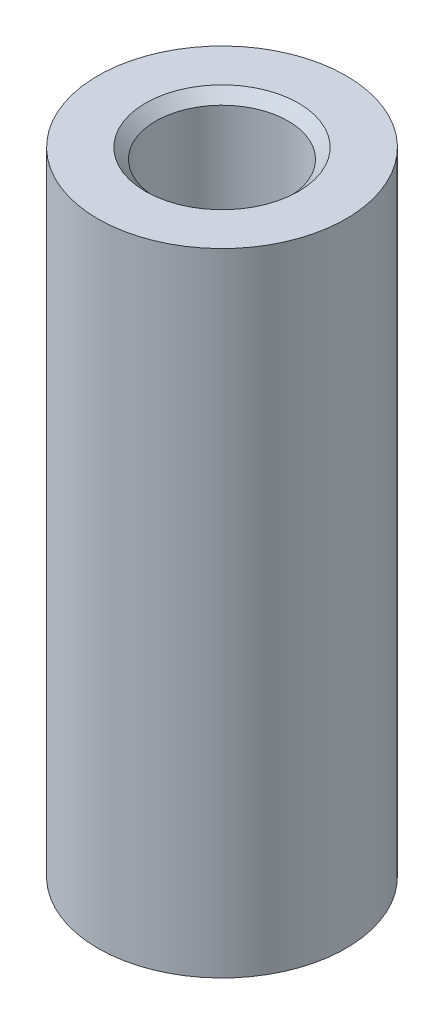
from build123d import *

# Parameters (mm, degrees)
SKETCH1_R            = 3
BOSS_EXTRUDE1_DEPTH  = 15.275
M3_CLEARANCE_HOLE1_D = 3.2
CHAMFER1_SIZE        = 0.25


with BuildPart() as part:
    # Sketch1 → Boss-Extrude1 (new body)
    with BuildSketch(Plane(origin=(0, 0, 0), x_dir=(1, 0, 0), z_dir=(0, 1, 0))):
        with Locations(Location((0, 0, 0), (0, 0, 270))):
            Circle(SKETCH1_R)
    extrude(amount=BOSS_EXTRUDE1_DEPTH)

    # M3 Clearance Hole1 (through all)
    with Locations(Plane(origin=(0, 15.275, 0), x_dir=(1, 0, 0), z_dir=(0, 1, 0))):
        with Locations((0, 0)):
            Hole(M3_CLEARANCE_HOLE1_D / 2)

    # Chamfer1
    chamfer1_edges = [part.edges().sort_by_distance(p)[0] for p in [
        (1.6, 15.275, 0),
        (1.6, 0, 0),
    ]]
    chamfer(chamfer1_edges, length=CHAMFER1_SIZE)


solid = part.part
